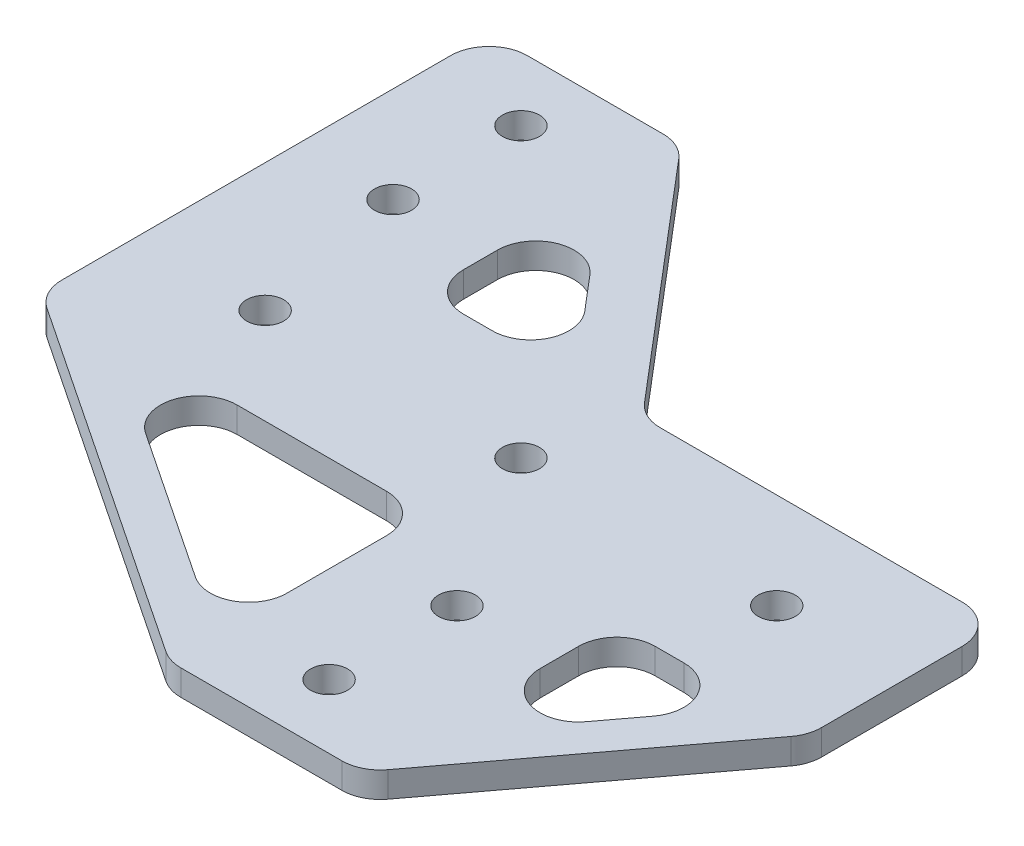
from build123d import *

# Parameters (mm, degrees)
SKETCH_1_R      = 1.45
EXTRUDE_1_DEPTH = 2
FILLET_1_R      = 3


with BuildPart() as part:
    # 草图1 → 凸台-拉伸1 (new body)
    with BuildSketch(Plane(origin=(0, 0, 0), x_dir=(1, 0, 0), z_dir=(0, 1, 0))):
        Polygon((0, 15), (0, 0), (30, -20), (45, -20), (60, 0), (60, 15), (52.613356649, 15), (45, 15), (32, 15), (15, 35), (0, 35), align=None)
        Polygon((30, -16.394448725), (5.408326913, 0), (30, 0), align=None, mode=Mode.SUBTRACT)
        with Locations(Location((37.5, -15, 0), (0, 0, 270))):
            Circle(SKETCH_1_R, mode=Mode.SUBTRACT)
        Polygon((45, 0), (56.25, 0), (45, -15), align=None, mode=Mode.SUBTRACT)
        with Locations(Location((37.5, -5, 0), (0, 0, 270))):
            Circle(SKETCH_1_R, mode=Mode.SUBTRACT)
        with Locations(Location((10, 7.5, 0), (0, 0, 270))):
            Circle(SKETCH_1_R, mode=Mode.SUBTRACT)
        with Locations(Location((7.5, 20, 0), (0, 0, 270))):
            Circle(SKETCH_1_R, mode=Mode.SUBTRACT)
        with Locations(Location((7.5, 30, 0), (0, 0, 270))):
            Circle(SKETCH_1_R, mode=Mode.SUBTRACT)
        Polygon((15, 28.82380953), (26.750238101, 15), (15, 15), align=None, mode=Mode.SUBTRACT)
        with Locations(Location((30, 7.5, 0), (0, 0, 270))):
            Circle(SKETCH_1_R, mode=Mode.SUBTRACT)
        with Locations(Location((50, 7.5, 0), (0, 0, 270))):
            Circle(SKETCH_1_R, mode=Mode.SUBTRACT)
    extrude(amount=EXTRUDE_1_DEPTH)

    # 圆角1
    fillet_1_edges = [part.edges().sort_by_distance(p)[0] for p in [
        (15, 1, -15),
        (26.750238101, 1, -15),
        (15, 1, -28.82380953),
        (45, 1, 15),
        (56.25, 1, 0),
        (45, 1, 0),
        (30, 1, 0),
        (5.408326913, 1, 0),
        (30, 1, 16.394448725),
        (60, 1, -15),
        (60, 1, 0),
        (45, 1, 20),
        (30, 1, 20),
        (0, 1, 0),
        (0, 1, -35),
        (15, 1, -35),
        (32, 1, -15),
    ]]
    fillet(fillet_1_edges, radius=FILLET_1_R)


solid = part.part
